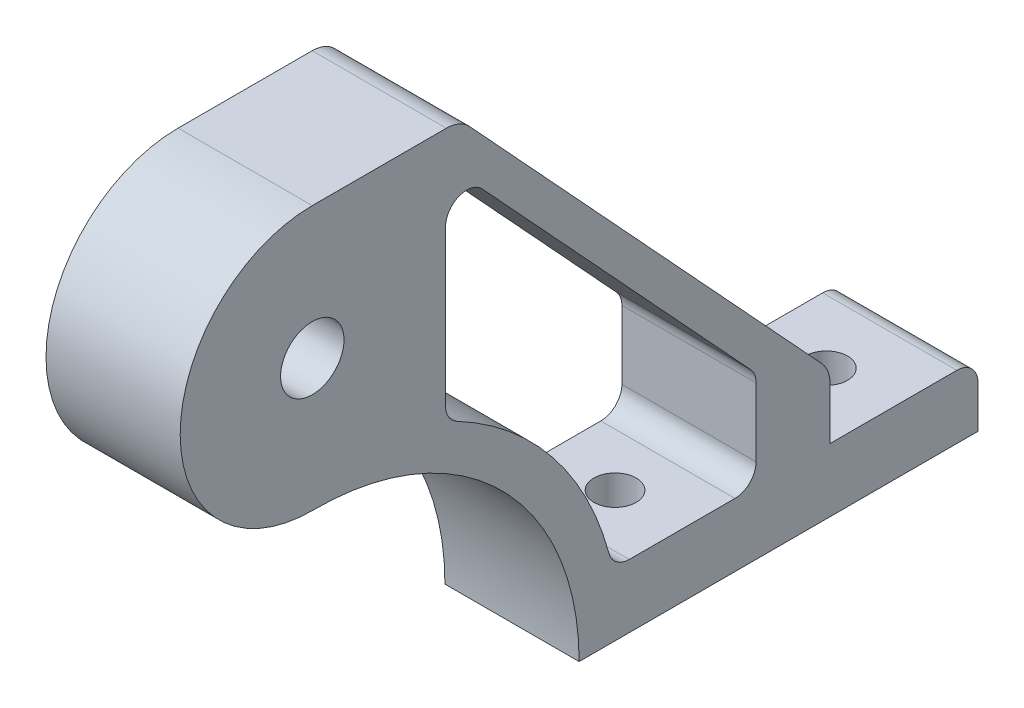
from build123d import *

# Parameters (mm, degrees)
SKETCH1_R             = 3
BOSS_EXTRUDE2_DEPTH   = 12.7
CROQUIS3_R            = 2
CORTAR_EXTRUIR2_DEPTH = 25


with BuildPart() as part:
    # Sketch1 → Boss-Extrude2 (new body)
    with BuildSketch(Plane(origin=(0, 0, 0), x_dir=(0, 0, -1), z_dir=(1, 0, 0))):
        with BuildLine():
            Line((49.204101374, 10.956842444), (15.890879059, 47.035174964))
            ThreePointArc((15.890879059, 47.035174964), (14.889789553, 47.748228965), (13.686777685, 48))
            Line((13.686777685, 48), (1, 48))
            ThreePointArc((1, 48), (-11.499928284, 35.457657454), (1.084684606, 23.000286863))
            ThreePointArc((1.084684606, 23.000286863), (18.871740524, 15.738310099), (26.254053819, -1.999139412))
            Line((26.254053819, -1.999139412), (64, -1.999139412))
            Line((64, -1.999139412), (64, 2.000860588))
            ThreePointArc((64, 2.000860588), (63.414213562, 3.41507415), (62, 4.000860588))
            Line((62, 4.000860588), (50, 4.000860588))
            Line((50, 4.000860588), (50, 8.921667481))
            ThreePointArc((50, 8.921667481), (49.793949187, 10.014300969), (49.204101374, 10.956842444))
        make_face()
        with Locations((1, 35.5)):
            Circle(SKETCH1_R, mode=Mode.SUBTRACT)
        with BuildLine():
            Line((42.469400916, 13.828321623), (17.083800106, 41.321013221))
            ThreePointArc((17.083800106, 41.321013221), (14.885976864, 41.826862703), (13.61439919, 39.964229912))
            Line((13.61439919, 39.964229912), (13.61439919, 25.251581588))
            ThreePointArc((13.61439919, 25.251581588), (13.901973758, 24.218334695), (14.681998331, 23.482223332))
            ThreePointArc((14.681998331, 23.482223332), (23.753909667, 15.98324163), (29.068629616, 5.481429706))
            ThreePointArc((29.068629616, 5.481429706), (29.78321361, 4.413589067), (31, 4.000860588))
            Line((31, 4.000860588), (41, 4.000860588))
            ThreePointArc((41, 4.000860588), (42.414213562, 4.586647025), (43, 6.000860588))
            Line((43, 6.000860588), (43, 12.471538314))
            ThreePointArc((43, 12.471538314), (42.862632792, 13.199960639), (42.469400916, 13.828321623))
        make_face(mode=Mode.SUBTRACT)
    extrude(amount=BOSS_EXTRUDE2_DEPTH)

    # Croquis3 → Cortar-Extruir2 (cut)
    with BuildSketch(Plane(origin=(0, 4.000860588, 0), x_dir=(1, 0, 0), z_dir=(0, 1, 0))):
        with Locations(Location((6.35, 56, 0), (0, 0, 270))):
            Circle(CROQUIS3_R)
        with Locations(Location((6.35, 36, 0), (0, 0, 270))):
            Circle(CROQUIS3_R)
    extrude(amount=-CORTAR_EXTRUIR2_DEPTH, mode=Mode.SUBTRACT)


solid = part.part
